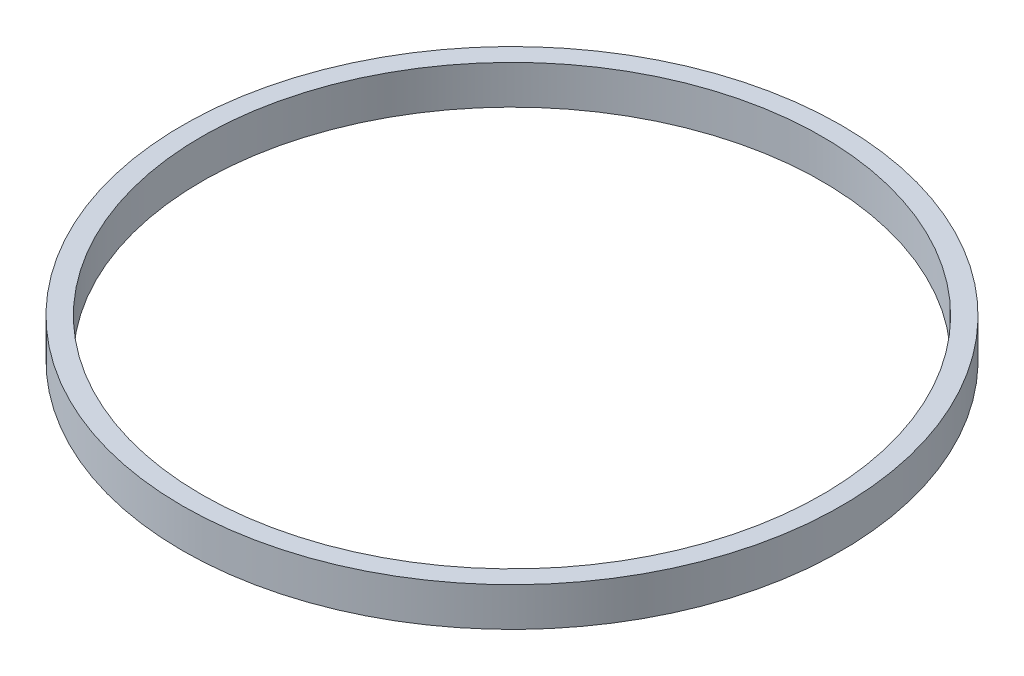
from build123d import *

# Parameters (mm, degrees)
IZIM1_R                     = 85
IZIM1_R_2                   = 80
Y_KSEKLIK_EKSTR_ZYON1_DEPTH = 10


with BuildPart() as part:
    # Çizim1 → Yükseklik-Ekstrüzyon1 (new body)
    with BuildSketch(Plane(origin=(0, 0, 0), x_dir=(1, 0, 0), z_dir=(0, 1, 0))):
        with Locations(Location((0, 0, 0), (0, 0, 270))):
            Circle(IZIM1_R)
        with Locations(Location((0, 0, 0), (0, 0, 270))):
            Circle(IZIM1_R_2, mode=Mode.SUBTRACT)
    extrude(amount=Y_KSEKLIK_EKSTR_ZYON1_DEPTH)


solid = part.part
